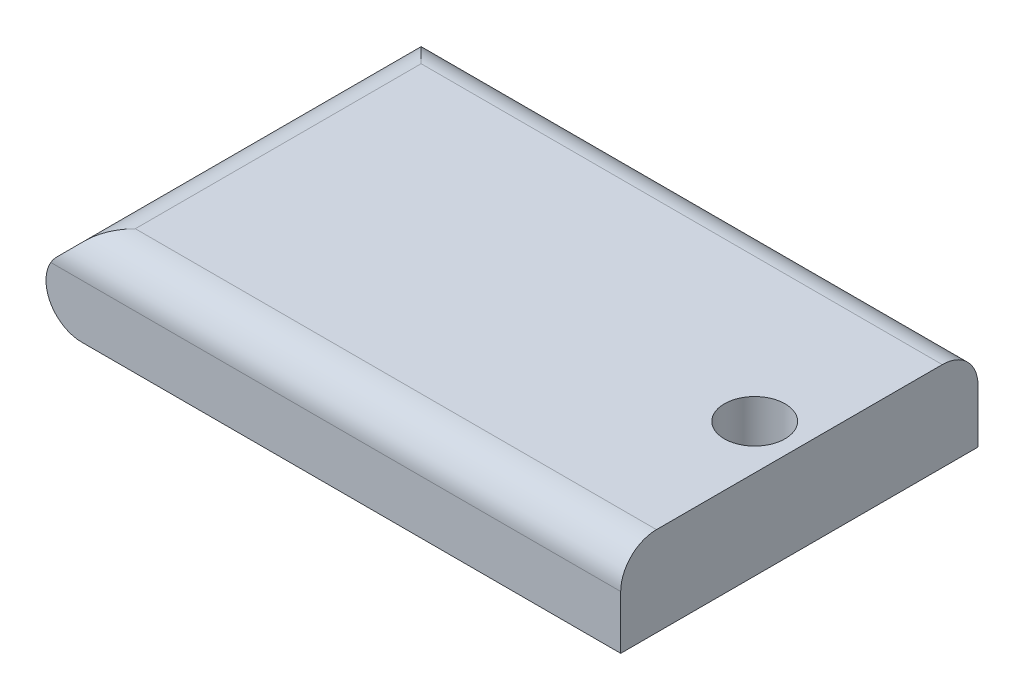
from build123d import *

# Parameters (mm, degrees)
EXTRUDE_1_DEPTH     = 20
SKETCH_2_R          = 1.7
CUT_EXTRUDE_1_DEPTH = 41.620192023
FILLET_1_R          = 2
FILLET_2_R          = 2


with BuildPart() as part:
    # ｽｹｯﾁ1 → ﾎﾞｽ - 押し出し1 (new body)
    with BuildSketch(Plane.XY):
        Polygon((0, 0), (-35, 0), (-30, 5), (0, 5), align=None)
    extrude(amount=EXTRUDE_1_DEPTH)

    # ｽｹｯﾁ2 → ｶｯﾄ - 押し出し1 (cut, through all)
    with BuildSketch(Plane(origin=(0, 5, 0), x_dir=(1, 0, 0), z_dir=(0, 1, 0))):
        with Locations(Location((-2.5, -10, 0), (0, 0, 270))):
            Circle(SKETCH_2_R)
    extrude(amount=-CUT_EXTRUDE_1_DEPTH, mode=Mode.SUBTRACT)

    # ﾌｨﾚｯﾄ1
    fillet_1_edges = [part.edges().sort_by_distance(p)[0] for p in [
        (-15, 5, 0),
        (-30, 5, 10),
        (-15, 5, 20),
    ]]
    fillet(fillet_1_edges, radius=FILLET_1_R)

    # ﾌｨﾚｯﾄ2
    fillet_2_edges = [part.edges().sort_by_distance(p)[0] for p in [
        (-35, 0, 10),
    ]]
    fillet(fillet_2_edges, radius=FILLET_2_R)


solid = part.part
